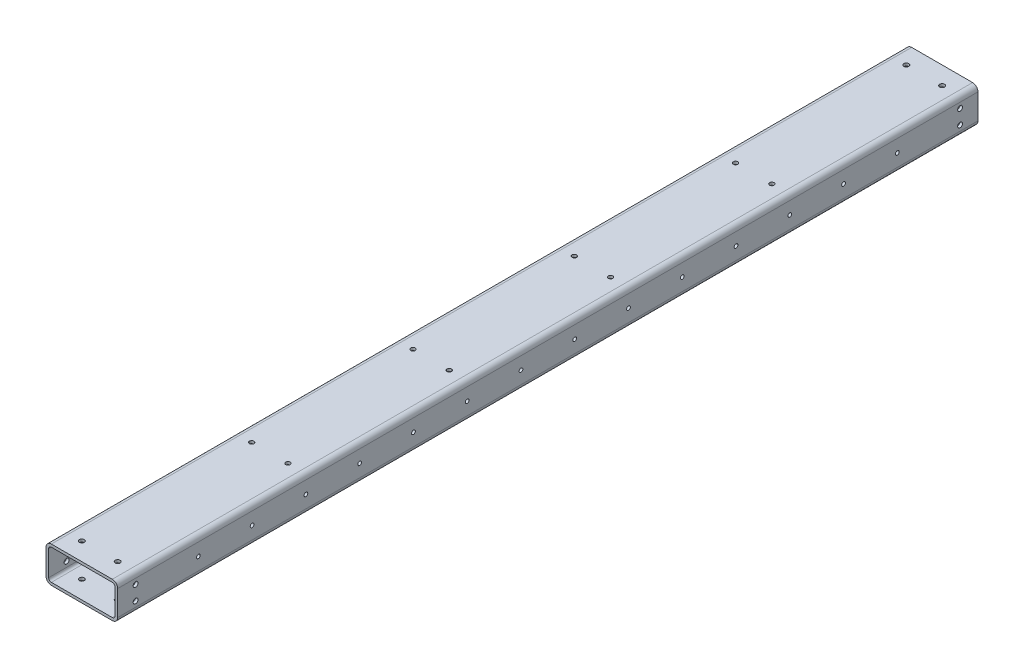
from build123d import *

# Parameters (mm, degrees)
AUFSATZ_LINEAR_AUSTRAGEN1_DEPTH = 480
LINEARES_MUSTER1_COUNT          = 14
LINEARES_MUSTER1_PITCH          = 60
SKIZZE5_R                       = 2.75
SCHNITT_LINEAR_AUSTRAGEN1_DEPTH = 100
SKIZZE6_R                       = 2.75
SCHNITT_LINEAR_AUSTRAGEN2_DEPTH = 100
SCHNITT_LINEAR_START            = -10
SKIZZE7_R                       = 2.1
SCHNITT_LINEAR_AUSTRAGEN3_DEPTH = 10
SKIZZE8_R                       = 2.5
SCHNITT_LINEAR_AUSTRAGEN4_DEPTH = 100
SKIZZE10_R                      = 2.75
SCHNITT_LINEAR_AUSTRAGEN6_DEPTH = 10


with BuildPart() as part:
    # Skizze1 → Aufsatz-Linear austragen1 (new, symmetric)
    with BuildSketch(Plane.XY):
        with BuildLine():
            Line((-34, 20), (34, 20))
            ThreePointArc((34, 20), (38.242640687, 18.242640687), (40, 14))
            Line((40, 14), (40, -14))
            ThreePointArc((40, -14), (38.242640687, -18.242640687), (34, -20))
            Line((34, -20), (-34, -20))
            ThreePointArc((-34, -20), (-38.242640687, -18.242640687), (-40, -14))
            Line((-40, -14), (-40, 14))
            ThreePointArc((-40, 14), (-38.242640687, 18.242640687), (-34, 20))
        make_face()
        with BuildLine():
            Line((-37, 14), (-37, -14))
            ThreePointArc((-37, -14), (-36.121320344, -16.121320344), (-34, -17))
            Line((-34, -17), (34, -17))
            ThreePointArc((34, -17), (36.121320344, -16.121320344), (37, -14))
            Line((37, -14), (37, 14))
            ThreePointArc((37, 14), (36.121320344, 16.121320344), (34, 17))
            Line((34, 17), (-34, 17))
            ThreePointArc((-34, 17), (-36.121320344, 16.121320344), (-37, 14))
        make_face(mode=Mode.SUBTRACT)
    extrude(amount=AUFSATZ_LINEAR_AUSTRAGEN1_DEPTH, both=True)

    # Skizze4 → M5 Gewindebohrung1 (revolve, cut)
    with BuildSketch(Plane(origin=(40, 0, -390), x_dir=(0, 0, -1), z_dir=(0, 1, 0))):
        Polygon((0, 0), (0, 15.2618073), (2.1, 14), (2.1, 0), align=None)
    m5_gewindebohrung1 = revolve(axis=Axis((46.35, 0, -390), (-1, 0, 0)), mode=Mode.SUBTRACT)

    # Lineares Muster1: M5 Gewindebohrung1 ×14
    with Locations(*[(0, 0, i * LINEARES_MUSTER1_PITCH) for i in range(1, LINEARES_MUSTER1_COUNT)]):
        add(m5_gewindebohrung1, mode=Mode.SUBTRACT)

    # Skizze5 → Schnitt-Linear austragen1 (cut)
    with BuildSketch(Plane(origin=(40, 0, 0), x_dir=(0, 0, -1), z_dir=(1, 0, 0))):
        with Locations((460, 8)):
            Circle(SKIZZE5_R)
        with Locations((460, -8)):
            Circle(SKIZZE5_R)
        with Locations(Location((-460, -8, 0), (0, 0, 270))):
            Circle(SKIZZE5_R)
        with Locations(Location((-460, 8, 0), (0, 0, 270))):
            Circle(SKIZZE5_R)
    extrude(amount=-SCHNITT_LINEAR_AUSTRAGEN1_DEPTH, mode=Mode.SUBTRACT)

    # Skizze6 → Schnitt-Linear austragen2 (cut)
    with BuildSketch(Plane(origin=(0, 20, 0), x_dir=(1, 0, 0), z_dir=(0, 1, 0))):
        with Locations(Location((20, -460, 0), (0, 0, 270))):
            Circle(SKIZZE6_R)
        with Locations(Location((-20, -460, 0), (0, 0, 90))):
            Circle(SKIZZE6_R)
        with Locations(Location((20, 460, 0), (0, 0, 90))):
            Circle(SKIZZE6_R)
        with Locations(Location((-20, 460, 0), (0, 0, 270))):
            Circle(SKIZZE6_R)
    extrude(amount=-SCHNITT_LINEAR_AUSTRAGEN2_DEPTH, mode=Mode.SUBTRACT)

    # Skizze7 → Schnitt-Linear austragen3 (cut)
    with BuildSketch(Plane.ZY.offset(40).offset(SCHNITT_LINEAR_START)):
        with Locations(Location((270, 0, 0), (0, 0, 180))):
            Circle(SKIZZE7_R)
        with Locations(Location((90, 0, 0), (0, 0, 180))):
            Circle(SKIZZE7_R)
        with Locations(Location((-90, 0, 0), (0, 0, 180))):
            Circle(SKIZZE7_R)
        with Locations(Location((-270, 0, 0), (0, 0, 180))):
            Circle(SKIZZE7_R)
    extrude(amount=SCHNITT_LINEAR_AUSTRAGEN3_DEPTH, mode=Mode.SUBTRACT)

    # Skizze8 → Schnitt-Linear austragen4 (cut)
    with BuildSketch(Plane(origin=(0, 20, 0), x_dir=(1, 0, 0), z_dir=(0, 1, 0))):
        with Locations(Location((20, 270, 0), (0, 0, 270))):
            Circle(SKIZZE8_R)
        with Locations(Location((20, 90, 0), (0, 0, 270))):
            Circle(SKIZZE8_R)
        with Locations(Location((-20.5, 90, 0), (0, 0, 90))):
            Circle(SKIZZE8_R)
        with Locations(Location((-20.5, 270, 0), (0, 0, 90))):
            Circle(SKIZZE8_R)
        with Locations(Location((20, -90, 0), (0, 0, 90))):
            Circle(SKIZZE8_R)
        with Locations(Location((-20.5, -90, 0), (0, 0, 270))):
            Circle(SKIZZE8_R)
        with Locations(Location((20, -270, 0), (0, 0, 90))):
            Circle(SKIZZE8_R)
        with Locations(Location((-20.5, -270, 0), (0, 0, 270))):
            Circle(SKIZZE8_R)
    extrude(amount=-SCHNITT_LINEAR_AUSTRAGEN4_DEPTH, mode=Mode.SUBTRACT)

    # Skizze10 → Schnitt-Linear austragen6 (cut)
    with BuildSketch(Plane.XZ.offset(20)):
        with Locations(Location((-9, -409, 0), (0, 0, 270))):
            Circle(SKIZZE10_R)
        with Locations(Location((-9, 348, 0), (0, 0, 270))):
            Circle(SKIZZE10_R)
        with Locations(Location((-9, -394, 0), (0, 0, 270))):
            Circle(SKIZZE10_R)
    extrude(amount=-SCHNITT_LINEAR_AUSTRAGEN6_DEPTH, mode=Mode.SUBTRACT)


solid = part.part
